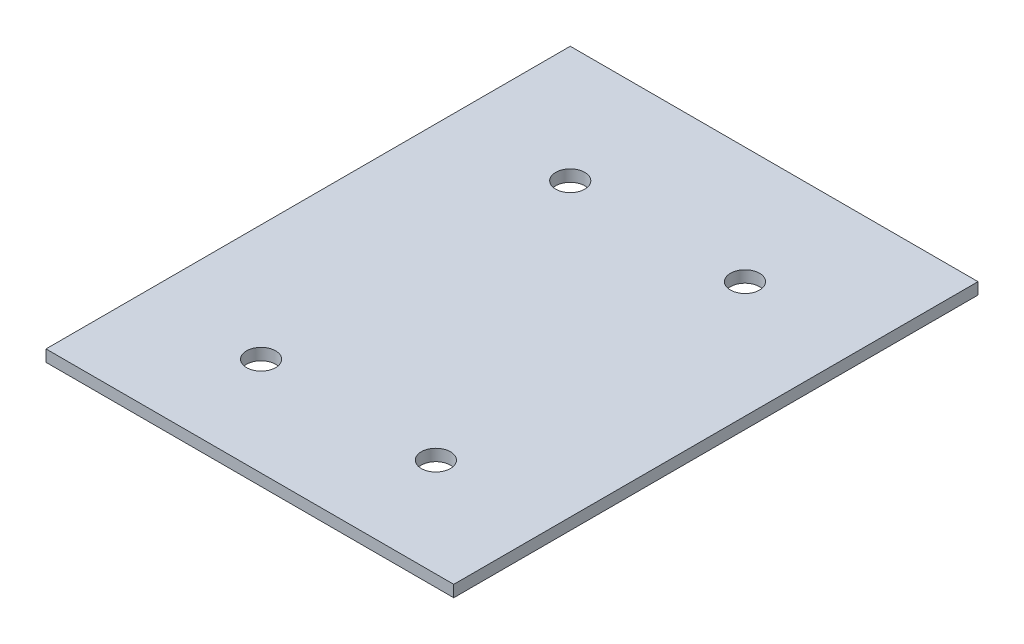
from build123d import *

# Parameters (mm, degrees)
SKETCH1_W           = 70
SKETCH1_H           = 90
SKETCH1_R           = 2.5
BOSS_EXTRUDE1_DEPTH = 2


with BuildPart() as part:
    # Sketch1 → Boss-Extrude1 (new body)
    with BuildSketch(Plane(origin=(0, 0, 0), x_dir=(1, 0, 0), z_dir=(0, 1, 0))):
        Rectangle(SKETCH1_W, SKETCH1_H)
        with Locations(Location((-15, 25, 0), (0, 0, 270))):
            Circle(SKETCH1_R, mode=Mode.SUBTRACT)
        with Locations(Location((15, 25, 0), (0, 0, 270))):
            Circle(SKETCH1_R, mode=Mode.SUBTRACT)
        with Locations(Location((-15, -28.071428571, 0), (0, 0, 270))):
            Circle(SKETCH1_R, mode=Mode.SUBTRACT)
        with Locations(Location((15, -28.071428571, 0), (0, 0, 270))):
            Circle(SKETCH1_R, mode=Mode.SUBTRACT)
    extrude(amount=BOSS_EXTRUDE1_DEPTH)


solid = part.part
